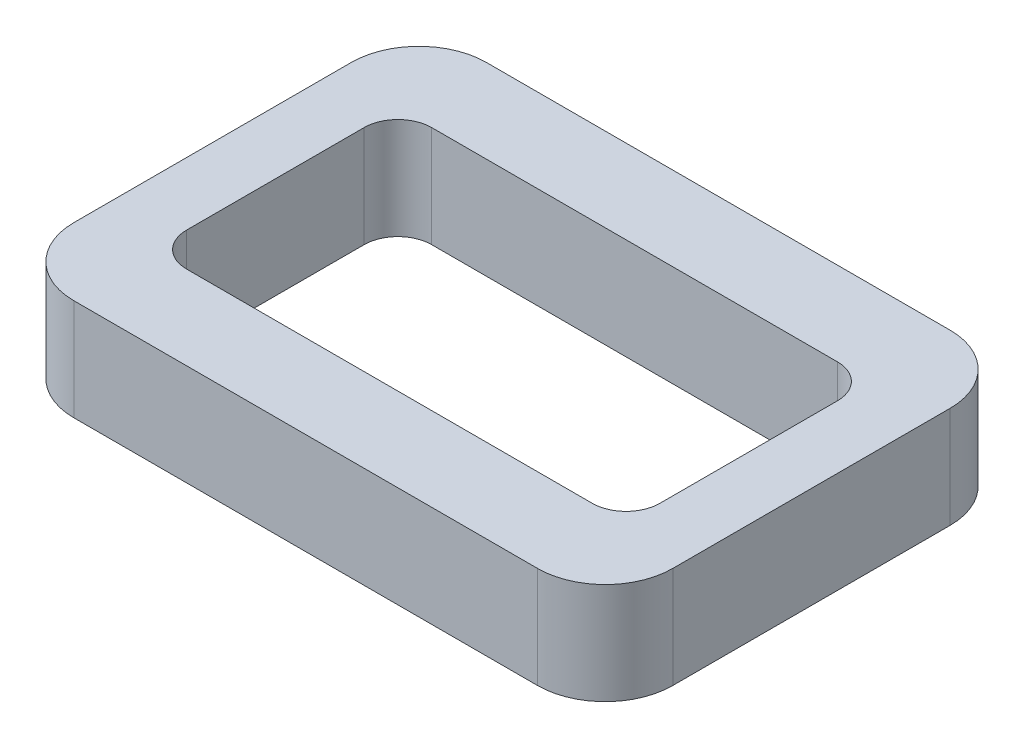
from build123d import *

# Parameters (mm, degrees)
BOSS_EXTRUDE1_DEPTH = 15.24


with BuildPart() as part:
    # Sketch2 → Boss-Extrude1 (new body)
    with BuildSketch(Plane(origin=(0, 0, 0), x_dir=(1, 0, 0), z_dir=(0, 1, 0))):
        with BuildLine():
            Line((81.8747525, 30.528055776), (12.1947525, 30.528055776))
            ThreePointArc((12.1947525, 30.528055776), (5.010547603, 27.552260673), (2.0347525, 20.368055776))
            Line((2.0347525, 20.368055776), (2.0347525, -21.311944224))
            ThreePointArc((2.0347525, -21.311944224), (5.010547603, -28.496149121), (12.1947525, -31.471944224))
            Line((12.1947525, -31.471944224), (81.8747525, -31.471944224))
            ThreePointArc((81.8747525, -31.471944224), (89.058957397, -28.496149121), (92.0347525, -21.311944224))
            Line((92.0347525, -21.311944224), (92.0347525, 20.368055776))
            ThreePointArc((92.0347525, 20.368055776), (89.058957397, 27.552260673), (81.8747525, 30.528055776))
        make_face()
        with BuildLine():
            Line((16.5547525, 17.943055776), (77.5147525, 17.943055776))
            ThreePointArc((77.5147525, 17.943055776), (81.106854948, 16.455158224), (82.5947525, 12.863055776))
            Line((82.5947525, 12.863055776), (82.5947525, -13.806944224))
            ThreePointArc((82.5947525, -13.806944224), (81.106854948, -17.399046672), (77.5147525, -18.886944224))
            Line((77.5147525, -18.886944224), (16.5547525, -18.886944224))
            ThreePointArc((16.5547525, -18.886944224), (12.962650051, -17.399046672), (11.4747525, -13.806944224))
            Line((11.4747525, -13.806944224), (11.4747525, 12.863055776))
            ThreePointArc((11.4747525, 12.863055776), (12.962650051, 16.455158224), (16.5547525, 17.943055776))
        make_face(mode=Mode.SUBTRACT)
    extrude(amount=BOSS_EXTRUDE1_DEPTH)


solid = part.part
